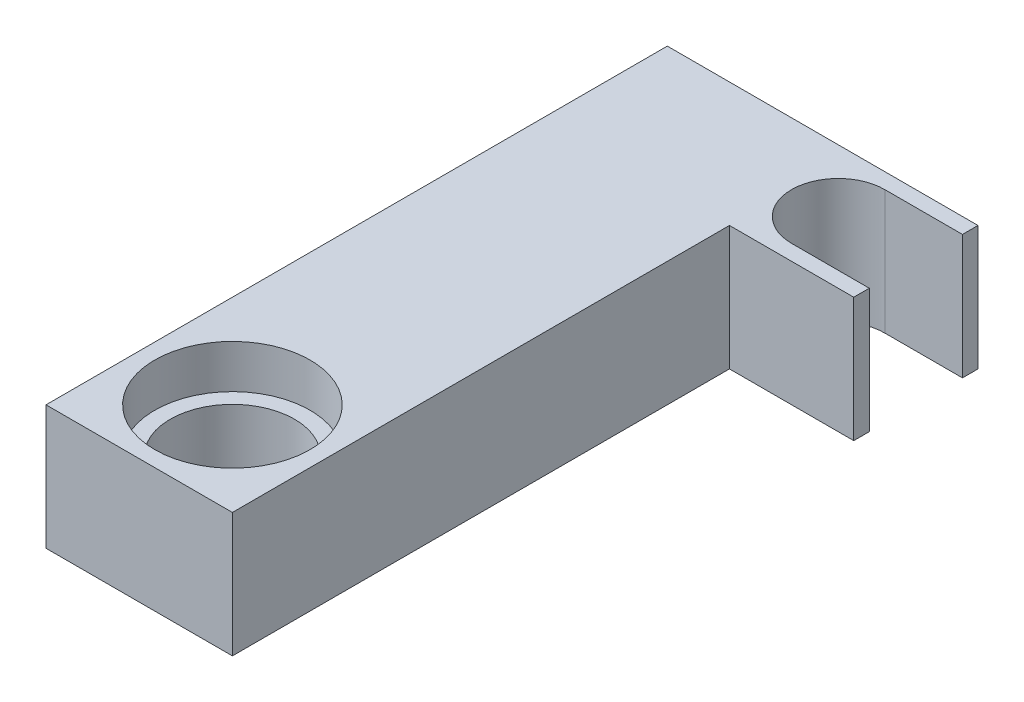
from build123d import *

# Parameters (mm, degrees)
SKETCH1_R           = 12.5
BOSS_EXTRUDE1_DEPTH = 20
SKETCH1_4_R         = 12.5
SKETCH1_4_R_2       = 10
BOSS_EXTRUDE2_DEPTH = 13


with BuildPart() as part:
    # Sketch1 → Boss-Extrude1 (new body)
    with BuildSketch(Plane(origin=(0, 0, 0), x_dir=(1, 0, 0), z_dir=(0, 1, 0))):
        with BuildLine():
            ThreePointArc((37.5, 82.5), (30, 90), (37.5, 97.5))
            Line((37.5, 97.5), (50, 97.5))
            Line((50, 97.5), (50, 100))
            Line((50, 100), (30, 100))
            Line((30, 100), (0, 100))
            Line((0, 100), (0, 0))
            Line((0, 0), (30, 0))
            Line((30, 0), (30, 80))
            Line((30, 80), (50, 80))
            Line((50, 80), (50, 82.5))
            Line((50, 82.5), (37.5, 82.5))
        make_face()
        with Locations((15, 15)):
            Circle(SKETCH1_R, mode=Mode.SUBTRACT)
    extrude(amount=BOSS_EXTRUDE1_DEPTH)

    # Sketch1<4> → Boss-Extrude2 (add)
    with BuildSketch(Plane(origin=(0, 0, 0), x_dir=(1, 0, 0), z_dir=(0, 1, 0))):
        with Locations((15, 15)):
            Circle(SKETCH1_4_R)
        with Locations((15, 15)):
            Circle(SKETCH1_4_R_2, mode=Mode.SUBTRACT)
    extrude(amount=BOSS_EXTRUDE2_DEPTH)


solid = part.part
